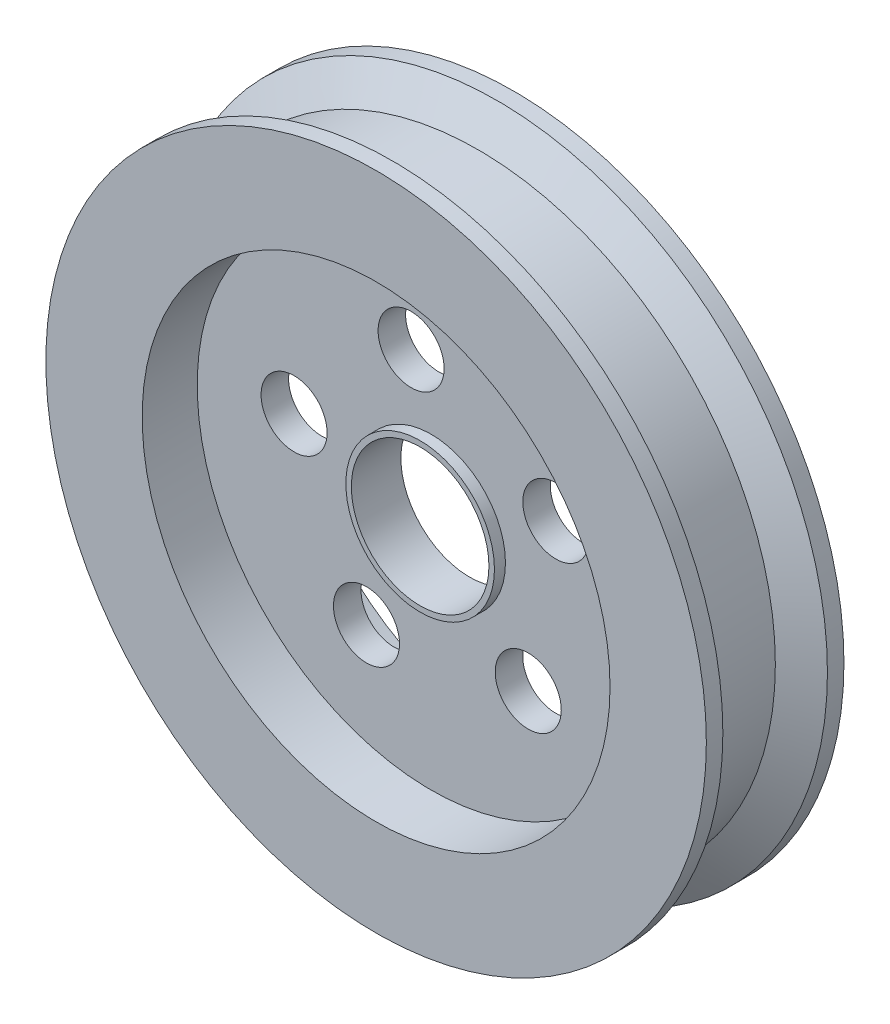
from build123d import *

# Parameters (mm, degrees)
SKETCH1_R                = 60
SKETCH1_R_2              = 12.5
BOSS_EXTRUDE1_DEPTH      = 12.5
SKETCH2_R                = 42.5
CUT_EXTRUDE1_DEPTH       = 10
SKETCH3_R                = 6
CUT_EXTRUDE2_DEPTH       = 87.168439698
CIRPATTERN2_COUNT        = 5
BOSS_EXTRUDE2_DEPTH      = 2
BOSS_EXTRUDE2_DEPTH_BACK = 7
SKETCH6_R                = 13.5
SKETCH6_R_2              = 12.5


with BuildPart() as part:
    # Sketch1 → Boss-Extrude1 (new, symmetric)
    with BuildSketch(Plane.XY):
        Circle(SKETCH1_R)
        Circle(SKETCH1_R_2, mode=Mode.SUBTRACT)
    extrude(amount=BOSS_EXTRUDE1_DEPTH, both=True)

    # Sketch2 → Cut-Extrude1 (cut)
    with BuildSketch(Plane.XY.offset(12.5)):
        Circle(SKETCH2_R)
    cut_extrude1 = extrude(amount=-CUT_EXTRUDE1_DEPTH, mode=Mode.SUBTRACT)

    # Mirror1: Cut-Extrude1 across plane
    add(cut_extrude1.mirror(Plane.XY), mode=Mode.SUBTRACT)

    # Sketch3 → Cut-Extrude2 (cut, through all)
    with BuildSketch(Plane.XY.offset(2.5)):
        with Locations((-3.63940485, 25)):
            Circle(SKETCH3_R)
    cut_extrude2 = extrude(amount=-CUT_EXTRUDE2_DEPTH, mode=Mode.SUBTRACT)

    # CirPattern2: Cut-Extrude2 ×5 about axis
    cirpattern2_axis = Axis((0, 0, 0), (0, 0, 1))
    for i in range(1, CIRPATTERN2_COUNT):
        add(cut_extrude2.rotate(cirpattern2_axis, i * 360 / CIRPATTERN2_COUNT), mode=Mode.SUBTRACT)

    # Sketch5 → Cut-Revolve1 (revolve, cut)
    with BuildSketch(Plane(origin=(0, 0, 0), x_dir=(1, 0, 0), z_dir=(0, 1, 0)), mode=Mode.PRIVATE) as cut_revolve1_sk:
        Polygon((-60, 9.5), (-54, 6.035898385), (-54, -6.035898385), (-60, -9.5), align=None)
    revolve(cut_revolve1_sk.sketch.rotate(Axis((0, 0, 0), (0, 0, -1)), 180), axis=Axis((0, 0, 0), (0, 0, -1)), mode=Mode.SUBTRACT)

    # Sketch6 → Boss-Extrude2 (add, two sides: drawn at the far end of the back side and taken through both)
    with BuildSketch(Plane.XY.offset(2.5).offset(-BOSS_EXTRUDE2_DEPTH_BACK)):
        Circle(SKETCH6_R)
        Circle(SKETCH6_R_2, mode=Mode.SUBTRACT)
    extrude(amount=BOSS_EXTRUDE2_DEPTH + BOSS_EXTRUDE2_DEPTH_BACK)


solid = part.part
